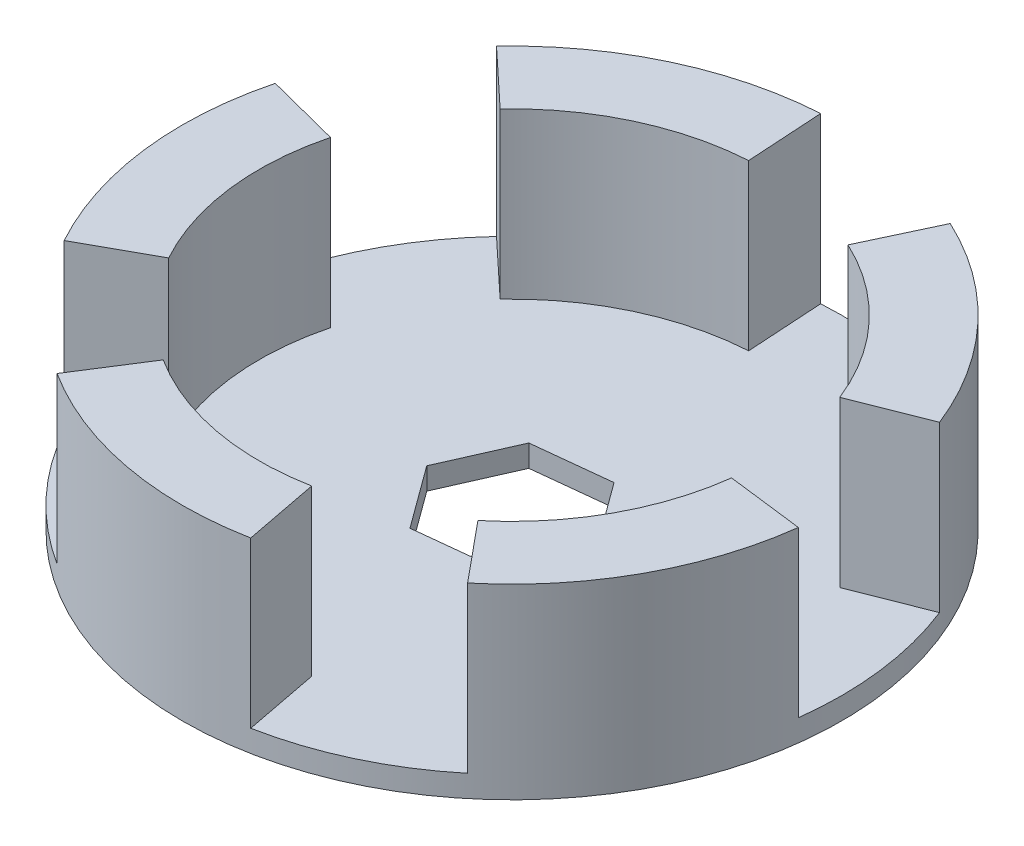
from build123d import *

# Parameters (mm, degrees)
SKETCH3_R           = 30
BOSS_EXTRUDE3_DEPTH = 2
BOSS_EXTRUDE4_DEPTH = 15
CUT_EXTRUDE1_DEPTH  = 10


with BuildPart() as part:
    # Sketch3 → Boss-Extrude3 (new body)
    with BuildSketch(Plane(origin=(0, 0, 0), x_dir=(1, 0, 0), z_dir=(0, 1, 0))):
        with Locations(Location((0, 0, 0), (0, 0, 270))):
            Circle(SKETCH3_R)
    extrude(amount=BOSS_EXTRUDE3_DEPTH)

    # Sketch4 → Boss-Extrude4 (add)
    with BuildSketch(Plane(origin=(0, 2, 0), x_dir=(1, 0, 0), z_dir=(0, 1, 0))):
        with BuildLine():
            Line((14.638601317, -17.740105735), (19.093827805, -23.13926835))
            ThreePointArc((19.093827805, -23.13926835), (26.293545079, -14.444704468), (29.770348498, -3.704908943))
            Line((29.770348498, -3.704908943), (22.823933849, -2.84043019))
            ThreePointArc((22.823933849, -2.84043019), (20.158384561, -11.074273425), (14.638601317, -17.740105735))
        make_face()
        with BuildLine():
            Line((21.39541974, 8.440143018), (27.907069226, 11.008882197))
            ThreePointArc((27.907069226, 11.008882197), (21.862882582, 20.542988225), (12.723121407, 27.168404106))
            Line((12.723121407, 27.168404106), (9.754393079, 20.829109814))
            ThreePointArc((9.754393079, 20.829109814), (16.761543313, 15.749624306), (21.39541974, 8.440143018))
        make_face()
        with BuildLine():
            Line((-1.415504714, 22.95640099), (-1.846310497, 29.943131726))
            ThreePointArc((-1.846310497, 29.943131726), (-12.781540551, 27.140969421), (-21.907027026, 20.495906101))
            Line((-21.907027026, 20.495906101), (-16.795387386, 15.713528011))
            ThreePointArc((-16.795387386, 15.713528011), (-9.799181089, 20.808076556), (-1.415504714, 22.95640099))
        make_face()
        with BuildLine():
            Line((-22.270249764, 5.747693053), (-29.048151867, 7.496990939))
            ThreePointArc((-29.048151867, 7.496990939), (-29.762309071, -3.768946635), (-26.262408702, -14.501237505))
            Line((-26.262408702, -14.501237505), (-20.134513338, -11.117615421))
            ThreePointArc((-20.134513338, -11.117615421), (-22.817770288, -2.889525753), (-22.270249764, 5.747693053))
        make_face()
        with BuildLine():
            Line((-12.348266578, -19.404131326), (-16.106434667, -25.309736512))
            ThreePointArc((-16.106434667, -25.309736512), (-5.612578038, -29.470306543), (5.675965822, -29.458163758))
            Line((5.675965822, -29.458163758), (4.351573797, -22.584592214))
            ThreePointArc((4.351573797, -22.584592214), (-4.302976496, -22.593901683), (-12.348266578, -19.404131326))
        make_face()
    extrude(amount=BOSS_EXTRUDE4_DEPTH)

    # Sketch5 → Cut-Extrude1 (cut)
    with BuildSketch(Plane.XZ):
        Polygon((7.002775602, -0.757936148), (4.157779759, 5.685613494), (-2.844995843, 6.443549642), (-7.002775602, 0.757936148), (-4.157779759, -5.685613494), (2.844995843, -6.443549642), align=None)
    extrude(amount=-CUT_EXTRUDE1_DEPTH, mode=Mode.SUBTRACT)


solid = part.part
